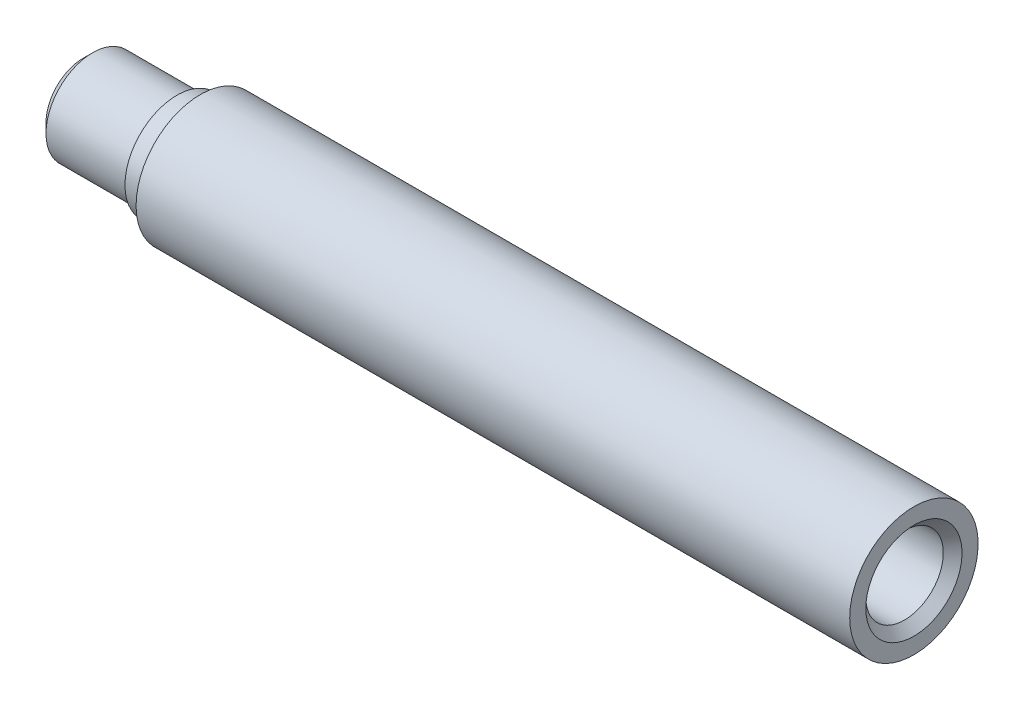
from build123d import *


with BuildPart() as part:
    # Sketch1 → Revolve1 (revolve)
    with BuildSketch(Plane(origin=(0, 0, 0), x_dir=(-1, 0, 0), z_dir=(0, 0, -1)), mode=Mode.PRIVATE) as revolve1_sk:
        Polygon((-19, 3.311374294), (-17.010325592, 0), (36, 0), (36, 3.187874294), (35.2, 3.987874294), (28, 3.987874294), (28, 4.437874294), (26, 4.437874294), (26, 5.487874294), (-35, 5.487874294), (-35, 4.111374294), (-34.2, 3.311374294), align=None)
    revolve(revolve1_sk.sketch.rotate(Axis((35, 0, 0), (-1, 0, 0)), 270), axis=Axis((35, 0, 0), (-1, 0, 0)))


solid = part.part
